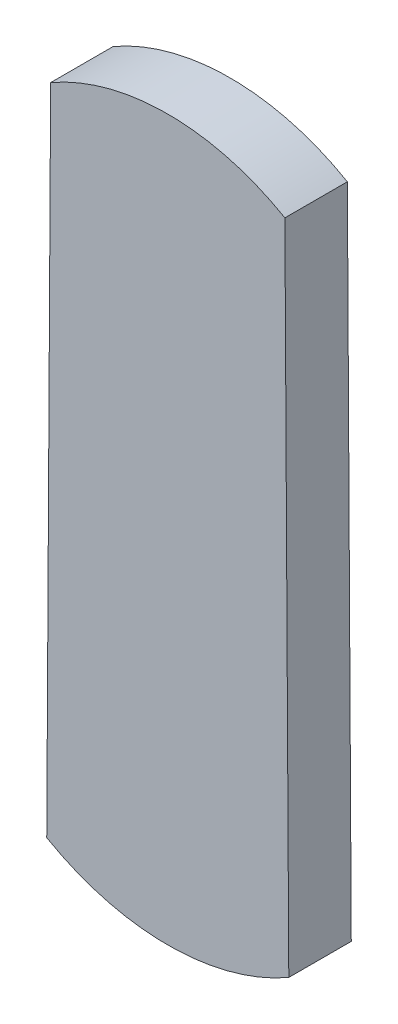
from build123d import *

# Parameters (mm, degrees)
BOSS_EXTRUDE1_DEPTH = 8


with BuildPart() as part:
    # Sketch1 → Boss-Extrude1 (new body)
    with BuildSketch(Plane.XY):
        with BuildLine():
            Line((-15, -4.019237886), (-15.5, -88.019237886))
            ThreePointArc((-15.5, -88.019237886), (0, -92.172450369), (15.5, -88.019237886))
            Line((15.5, -88.019237886), (15, -4.019237886))
            ThreePointArc((15, -4.019237886), (0, 0), (-15, -4.019237886))
        make_face()
    extrude(amount=BOSS_EXTRUDE1_DEPTH)


solid = part.part
